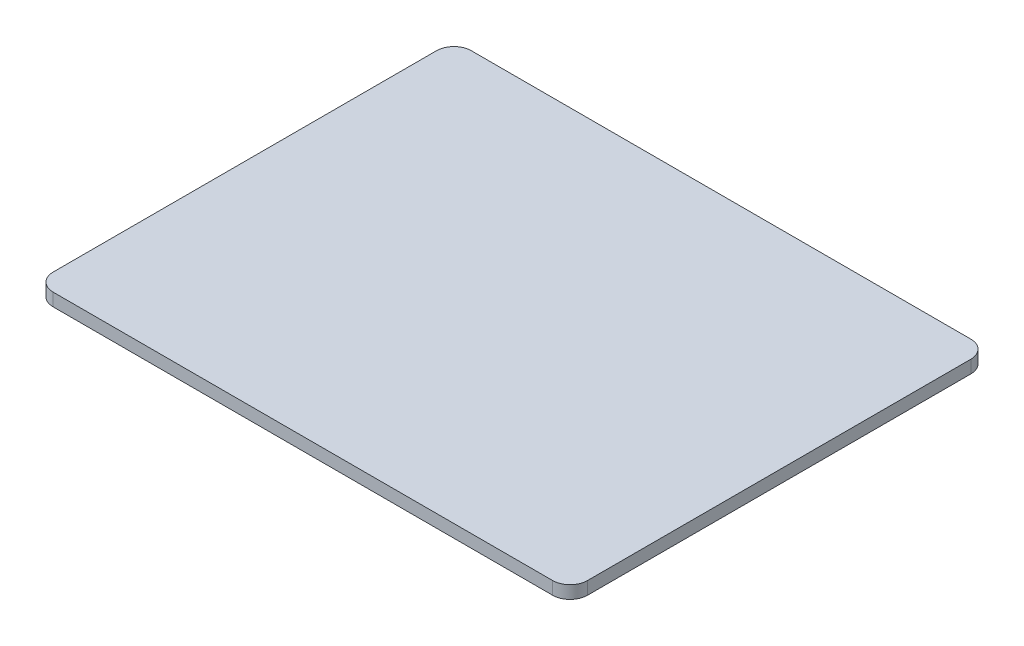
from build123d import *

# Parameters (mm, degrees)
BOSS_EXTRUDE1_DEPTH = 1.1


with BuildPart() as part:
    # Sketch1 → Boss-Extrude1 (new body)
    with BuildSketch(Plane(origin=(0, 0, 0), x_dir=(1, 0, 0), z_dir=(0, 1, 0))):
        with BuildLine():
            Line((-21.5, 18), (21.5, 18))
            ThreePointArc((21.5, 18), (22.560660172, 17.560660172), (23, 16.5))
            Line((23, 16.5), (23, -16.5))
            ThreePointArc((23, -16.5), (22.560660172, -17.560660172), (21.5, -18))
            Line((21.5, -18), (-21.5, -18))
            ThreePointArc((-21.5, -18), (-22.560660172, -17.560660172), (-23, -16.5))
            Line((-23, -16.5), (-23, 16.5))
            ThreePointArc((-23, 16.5), (-22.560660172, 17.560660172), (-21.5, 18))
        make_face()
    extrude(amount=BOSS_EXTRUDE1_DEPTH)


solid = part.part
